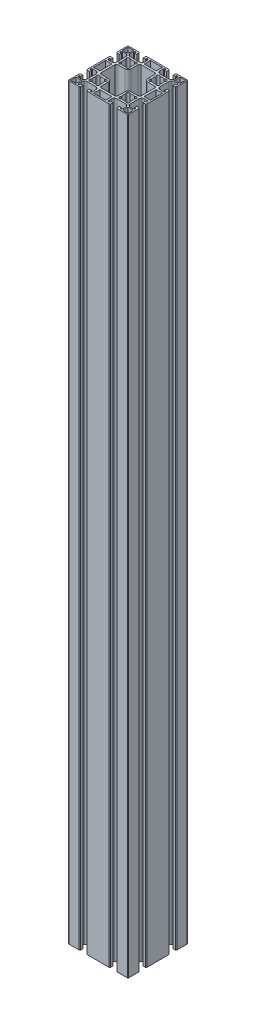
from build123d import *

# Parameters (mm, degrees)
SKETCH1_W           = 8.4
SKETCH1_H           = 16.2
SKETCH1_W_2         = 7.2
SKETCH1_H_2         = 7.2
SKETCH1_W_3         = 16.2
SKETCH1_H_3         = 8.4
BOSS_EXTRUDE1_DEPTH = 1000


with BuildPart() as part:
    # Sketch1 → Boss-Extrude1 (new body)
    with BuildSketch(Plane(origin=(0, 0, 0), x_dir=(1, 0, 0), z_dir=(0, 1, 0))):
        with BuildLine():
            Line((39.881157874, -42.704615906), (39.881157874, -28.954615906))
            Line((39.881157874, -28.954615906), (38.881157874, -27.954615906))
            Line((38.881157874, -27.954615906), (35.881157874, -27.954615906))
            Line((35.881157874, -27.954615906), (35.881157874, -30.954615906))
            Line((35.881157874, -30.954615906), (37.485281077, -30.954615906))
            ThreePointArc((37.485281077, -30.954615906), (37.868303299, -31.133222101), (37.977684954, -31.541439995))
            Line((37.977684954, -31.541439995), (37.797926779, -32.560899266))
            ThreePointArc((37.797926779, -32.560899266), (37.49010865, -33.094055905), (36.911599801, -33.304615906))
            Line((36.911599801, -33.304615906), (32.215023493, -33.304615906))
            ThreePointArc((32.215023493, -33.304615906), (31.066973196, -33.076254504), (30.09370315, -32.42593625))
            Line((30.09370315, -32.42593625), (29.55983753, -31.89207063))
            ThreePointArc((29.55983753, -31.89207063), (28.909519276, -30.918800583), (28.681157874, -29.770750286))
            Line((28.681157874, -29.770750286), (28.681157874, -17.638481526))
            ThreePointArc((28.681157874, -17.638481526), (28.909519276, -16.490431229), (29.55983753, -15.517161182))
            Line((29.55983753, -15.517161182), (30.09370315, -14.983295562))
            ThreePointArc((30.09370315, -14.983295562), (31.066973196, -14.332977309), (32.215023493, -14.104615906))
            Line((32.215023493, -14.104615906), (36.911599801, -14.104615906))
            ThreePointArc((36.911599801, -14.104615906), (37.49010865, -14.315175907), (37.797926779, -14.848332546))
            Line((37.797926779, -14.848332546), (37.977684954, -15.867791817))
            ThreePointArc((37.977684954, -15.867791817), (37.868303299, -16.276009711), (37.485281077, -16.454615906))
            Line((37.485281077, -16.454615906), (35.881157874, -16.454615906))
            Line((35.881157874, -16.454615906), (35.881157874, -19.454615906))
            Line((35.881157874, -19.454615906), (38.881157874, -19.454615906))
            Line((38.881157874, -19.454615906), (39.881157874, -18.454615906))
            Line((39.881157874, -18.454615906), (39.881157874, 11.045384094))
            Line((39.881157874, 11.045384094), (38.881157874, 12.045384094))
            Line((38.881157874, 12.045384094), (35.881157874, 12.045384094))
            Line((35.881157874, 12.045384094), (35.881157874, 9.045384094))
            Line((35.881157874, 9.045384094), (37.485281077, 9.045384094))
            ThreePointArc((37.485281077, 9.045384094), (37.868303299, 8.866777899), (37.977684954, 8.458560005))
            Line((37.977684954, 8.458560005), (37.797926779, 7.439100734))
            ThreePointArc((37.797926779, 7.439100734), (37.49010865, 6.905944095), (36.911599801, 6.695384094))
            Line((36.911599801, 6.695384094), (32.215023493, 6.695384094))
            ThreePointArc((32.215023493, 6.695384094), (31.066973196, 6.923745496), (30.09370315, 7.57406375))
            Line((30.09370315, 7.57406375), (29.55983753, 8.10792937))
            ThreePointArc((29.55983753, 8.10792937), (28.909519276, 9.081199417), (28.681157874, 10.229249714))
            Line((28.681157874, 10.229249714), (28.681157874, 22.361518474))
            ThreePointArc((28.681157874, 22.361518474), (28.909519276, 23.509568771), (29.55983753, 24.482838818))
            Line((29.55983753, 24.482838818), (30.09370315, 25.016704438))
            ThreePointArc((30.09370315, 25.016704438), (31.066973196, 25.667022691), (32.215023493, 25.895384094))
            Line((32.215023493, 25.895384094), (36.911599801, 25.895384094))
            ThreePointArc((36.911599801, 25.895384094), (37.49010865, 25.684824093), (37.797926779, 25.151667454))
            Line((37.797926779, 25.151667454), (37.977684954, 24.132208183))
            ThreePointArc((37.977684954, 24.132208183), (37.868303299, 23.723990289), (37.485281077, 23.545384094))
            Line((37.485281077, 23.545384094), (35.881157874, 23.545384094))
            Line((35.881157874, 23.545384094), (35.881157874, 20.545384094))
            Line((35.881157874, 20.545384094), (38.881157874, 20.545384094))
            Line((38.881157874, 20.545384094), (39.881157874, 21.545384094))
            Line((39.881157874, 21.545384094), (39.881157874, 35.295384094))
            ThreePointArc((39.881157874, 35.295384094), (39.588264655, 36.002490875), (38.881157874, 36.295384094))
            Line((38.881157874, 36.295384094), (25.131157874, 36.295384094))
            Line((25.131157874, 36.295384094), (24.131157874, 35.295384094))
            Line((24.131157874, 35.295384094), (24.131157874, 32.295384094))
            Line((24.131157874, 32.295384094), (27.131157874, 32.295384094))
            Line((27.131157874, 32.295384094), (27.131157874, 33.899507298))
            ThreePointArc((27.131157874, 33.899507298), (27.309764069, 34.282529519), (27.717981962, 34.391911174))
            Line((27.717981962, 34.391911174), (28.737441233, 34.212152999))
            ThreePointArc((28.737441233, 34.212152999), (29.270597872, 33.90433487), (29.481157874, 33.325826021))
            Line((29.481157874, 33.325826021), (29.481157874, 28.629249714))
            ThreePointArc((29.481157874, 28.629249714), (29.252796471, 27.481199417), (28.602478217, 26.50792937))
            Line((28.602478217, 26.50792937), (28.068612597, 25.97406375))
            ThreePointArc((28.068612597, 25.97406375), (27.095342551, 25.323745496), (25.947292254, 25.095384094))
            Line((25.947292254, 25.095384094), (13.815023493, 25.095384094))
            ThreePointArc((13.815023493, 25.095384094), (12.666973196, 25.323745496), (11.69370315, 25.97406375))
            Line((11.69370315, 25.97406375), (11.15983753, 26.50792937))
            ThreePointArc((11.15983753, 26.50792937), (10.509519276, 27.481199417), (10.281157874, 28.629249714))
            Line((10.281157874, 28.629249714), (10.281157874, 33.325826021))
            ThreePointArc((10.281157874, 33.325826021), (10.491717875, 33.90433487), (11.024874514, 34.212152999))
            Line((11.024874514, 34.212152999), (12.044333785, 34.391911174))
            ThreePointArc((12.044333785, 34.391911174), (12.452551678, 34.282529519), (12.631157874, 33.899507298))
            Line((12.631157874, 33.899507298), (12.631157874, 32.295384094))
            Line((12.631157874, 32.295384094), (15.631157874, 32.295384094))
            Line((15.631157874, 32.295384094), (15.631157874, 35.295384094))
            Line((15.631157874, 35.295384094), (14.631157874, 36.295384094))
            Line((14.631157874, 36.295384094), (-14.868842126, 36.295384094))
            Line((-14.868842126, 36.295384094), (-15.868842126, 35.295384094))
            Line((-15.868842126, 35.295384094), (-15.868842126, 32.295384094))
            Line((-15.868842126, 32.295384094), (-12.868842126, 32.295384094))
            Line((-12.868842126, 32.295384094), (-12.868842126, 33.899507298))
            ThreePointArc((-12.868842126, 33.899507298), (-12.690235931, 34.282529519), (-12.282018038, 34.391911174))
            Line((-12.282018038, 34.391911174), (-11.262558767, 34.212152999))
            ThreePointArc((-11.262558767, 34.212152999), (-10.729402128, 33.90433487), (-10.518842126, 33.325826021))
            Line((-10.518842126, 33.325826021), (-10.518842126, 28.629249714))
            ThreePointArc((-10.518842126, 28.629249714), (-10.747203529, 27.481199417), (-11.397521783, 26.50792937))
            Line((-11.397521783, 26.50792937), (-11.931387403, 25.97406375))
            ThreePointArc((-11.931387403, 25.97406375), (-12.904657449, 25.323745496), (-14.052707746, 25.095384094))
            Line((-14.052707746, 25.095384094), (-26.184976507, 25.095384094))
            ThreePointArc((-26.184976507, 25.095384094), (-27.333026804, 25.323745496), (-28.30629685, 25.97406375))
            Line((-28.30629685, 25.97406375), (-28.84016247, 26.50792937))
            ThreePointArc((-28.84016247, 26.50792937), (-29.490480724, 27.481199417), (-29.718842126, 28.629249714))
            Line((-29.718842126, 28.629249714), (-29.718842126, 33.325826021))
            ThreePointArc((-29.718842126, 33.325826021), (-29.508282125, 33.90433487), (-28.975125486, 34.212152999))
            Line((-28.975125486, 34.212152999), (-27.955666215, 34.391911174))
            ThreePointArc((-27.955666215, 34.391911174), (-27.547448322, 34.282529519), (-27.368842126, 33.899507298))
            Line((-27.368842126, 33.899507298), (-27.368842126, 32.295384094))
            Line((-27.368842126, 32.295384094), (-24.368842126, 32.295384094))
            Line((-24.368842126, 32.295384094), (-24.368842126, 35.295384094))
            Line((-24.368842126, 35.295384094), (-25.368842126, 36.295384094))
            Line((-25.368842126, 36.295384094), (-39.118842126, 36.295384094))
            ThreePointArc((-39.118842126, 36.295384094), (-39.825948908, 36.002490875), (-40.118842126, 35.295384094))
            Line((-40.118842126, 35.295384094), (-40.118842126, 21.545384094))
            Line((-40.118842126, 21.545384094), (-39.118842126, 20.545384094))
            Line((-39.118842126, 20.545384094), (-36.118842126, 20.545384094))
            Line((-36.118842126, 20.545384094), (-36.118842126, 23.545384094))
            Line((-36.118842126, 23.545384094), (-37.72296533, 23.545384094))
            ThreePointArc((-37.72296533, 23.545384094), (-38.105987552, 23.723990289), (-38.215369207, 24.132208183))
            Line((-38.215369207, 24.132208183), (-38.035611031, 25.151667454))
            ThreePointArc((-38.035611031, 25.151667454), (-37.727792902, 25.684824093), (-37.149284054, 25.895384094))
            Line((-37.149284054, 25.895384094), (-32.452707746, 25.895384094))
            ThreePointArc((-32.452707746, 25.895384094), (-31.304657449, 25.667022691), (-30.331387403, 25.016704438))
            Line((-30.331387403, 25.016704438), (-29.797521783, 24.482838818))
            ThreePointArc((-29.797521783, 24.482838818), (-29.147203529, 23.509568771), (-28.918842126, 22.361518474))
            Line((-28.918842126, 22.361518474), (-28.918842126, 10.229249714))
            ThreePointArc((-28.918842126, 10.229249714), (-29.147203529, 9.081199417), (-29.797521783, 8.10792937))
            Line((-29.797521783, 8.10792937), (-30.331387403, 7.57406375))
            ThreePointArc((-30.331387403, 7.57406375), (-31.304657449, 6.923745496), (-32.452707746, 6.695384094))
            Line((-32.452707746, 6.695384094), (-37.149284054, 6.695384094))
            ThreePointArc((-37.149284054, 6.695384094), (-37.727792902, 6.905944095), (-38.035611031, 7.439100734))
            Line((-38.035611031, 7.439100734), (-38.215369207, 8.458560005))
            ThreePointArc((-38.215369207, 8.458560005), (-38.105987552, 8.866777899), (-37.72296533, 9.045384094))
            Line((-37.72296533, 9.045384094), (-36.118842126, 9.045384094))
            Line((-36.118842126, 9.045384094), (-36.118842126, 12.045384094))
            Line((-36.118842126, 12.045384094), (-39.118842126, 12.045384094))
            Line((-39.118842126, 12.045384094), (-40.118842126, 11.045384094))
            Line((-40.118842126, 11.045384094), (-40.118842126, -18.454615906))
            Line((-40.118842126, -18.454615906), (-39.118842126, -19.454615906))
            Line((-39.118842126, -19.454615906), (-36.118842126, -19.454615906))
            Line((-36.118842126, -19.454615906), (-36.118842126, -16.454615906))
            Line((-36.118842126, -16.454615906), (-37.72296533, -16.454615906))
            ThreePointArc((-37.72296533, -16.454615906), (-38.105987552, -16.276009711), (-38.215369207, -15.867791817))
            Line((-38.215369207, -15.867791817), (-38.035611031, -14.848332546))
            ThreePointArc((-38.035611031, -14.848332546), (-37.727792902, -14.315175907), (-37.149284054, -14.104615906))
            Line((-37.149284054, -14.104615906), (-32.452707746, -14.104615906))
            ThreePointArc((-32.452707746, -14.104615906), (-31.304657449, -14.332977309), (-30.331387403, -14.983295562))
            Line((-30.331387403, -14.983295562), (-29.797521783, -15.517161182))
            ThreePointArc((-29.797521783, -15.517161182), (-29.147203529, -16.490431229), (-28.918842126, -17.638481526))
            Line((-28.918842126, -17.638481526), (-28.918842126, -29.770750286))
            ThreePointArc((-28.918842126, -29.770750286), (-29.147203529, -30.918800583), (-29.797521783, -31.89207063))
            Line((-29.797521783, -31.89207063), (-30.331387403, -32.42593625))
            ThreePointArc((-30.331387403, -32.42593625), (-31.304657449, -33.076254504), (-32.452707746, -33.304615906))
            Line((-32.452707746, -33.304615906), (-37.149284054, -33.304615906))
            ThreePointArc((-37.149284054, -33.304615906), (-37.727792902, -33.094055905), (-38.035611031, -32.560899266))
            Line((-38.035611031, -32.560899266), (-38.215369207, -31.541439995))
            ThreePointArc((-38.215369207, -31.541439995), (-38.105987552, -31.133222101), (-37.72296533, -30.954615906))
            Line((-37.72296533, -30.954615906), (-36.118842126, -30.954615906))
            Line((-36.118842126, -30.954615906), (-36.118842126, -27.954615906))
            Line((-36.118842126, -27.954615906), (-39.118842126, -27.954615906))
            Line((-39.118842126, -27.954615906), (-40.118842126, -28.954615906))
            Line((-40.118842126, -28.954615906), (-40.118842126, -42.704615906))
            ThreePointArc((-40.118842126, -42.704615906), (-39.825948908, -43.411722687), (-39.118842126, -43.704615906))
            Line((-39.118842126, -43.704615906), (-25.368842126, -43.704615906))
            Line((-25.368842126, -43.704615906), (-24.368842126, -42.704615906))
            Line((-24.368842126, -42.704615906), (-24.368842126, -39.704615906))
            Line((-24.368842126, -39.704615906), (-27.368842126, -39.704615906))
            Line((-27.368842126, -39.704615906), (-27.368842126, -41.30873911))
            ThreePointArc((-27.368842126, -41.30873911), (-27.547448322, -41.691761331), (-27.955666215, -41.801142986))
            Line((-27.955666215, -41.801142986), (-28.975125486, -41.621384811))
            ThreePointArc((-28.975125486, -41.621384811), (-29.508282125, -41.313566682), (-29.718842126, -40.735057833))
            Line((-29.718842126, -40.735057833), (-29.718842126, -36.038481526))
            ThreePointArc((-29.718842126, -36.038481526), (-29.490480724, -34.890431229), (-28.84016247, -33.917161182))
            Line((-28.84016247, -33.917161182), (-28.30629685, -33.383295562))
            ThreePointArc((-28.30629685, -33.383295562), (-27.333026804, -32.732977309), (-26.184976507, -32.504615906))
            Line((-26.184976507, -32.504615906), (-14.052707746, -32.504615906))
            ThreePointArc((-14.052707746, -32.504615906), (-12.904657449, -32.732977309), (-11.931387403, -33.383295562))
            Line((-11.931387403, -33.383295562), (-11.397521783, -33.917161182))
            ThreePointArc((-11.397521783, -33.917161182), (-10.747203529, -34.890431229), (-10.518842126, -36.038481526))
            Line((-10.518842126, -36.038481526), (-10.518842126, -40.735057833))
            ThreePointArc((-10.518842126, -40.735057833), (-10.729402128, -41.313566682), (-11.262558767, -41.621384811))
            Line((-11.262558767, -41.621384811), (-12.282018038, -41.801142986))
            ThreePointArc((-12.282018038, -41.801142986), (-12.690235931, -41.691761331), (-12.868842126, -41.30873911))
            Line((-12.868842126, -41.30873911), (-12.868842126, -39.704615906))
            Line((-12.868842126, -39.704615906), (-15.868842126, -39.704615906))
            Line((-15.868842126, -39.704615906), (-15.868842126, -42.704615906))
            Line((-15.868842126, -42.704615906), (-14.868842126, -43.704615906))
            Line((-14.868842126, -43.704615906), (14.631157874, -43.704615906))
            Line((14.631157874, -43.704615906), (15.631157874, -42.704615906))
            Line((15.631157874, -42.704615906), (15.631157874, -39.704615906))
            Line((15.631157874, -39.704615906), (12.631157874, -39.704615906))
            Line((12.631157874, -39.704615906), (12.631157874, -41.30873911))
            ThreePointArc((12.631157874, -41.30873911), (12.452551678, -41.691761331), (12.044333785, -41.801142986))
            Line((12.044333785, -41.801142986), (11.024874514, -41.621384811))
            ThreePointArc((11.024874514, -41.621384811), (10.491717875, -41.313566682), (10.281157874, -40.735057833))
            Line((10.281157874, -40.735057833), (10.281157874, -36.038481526))
            ThreePointArc((10.281157874, -36.038481526), (10.509519276, -34.890431229), (11.15983753, -33.917161182))
            Line((11.15983753, -33.917161182), (11.69370315, -33.383295562))
            ThreePointArc((11.69370315, -33.383295562), (12.666973196, -32.732977309), (13.815023493, -32.504615906))
            Line((13.815023493, -32.504615906), (25.947292254, -32.504615906))
            ThreePointArc((25.947292254, -32.504615906), (27.095342551, -32.732977309), (28.068612597, -33.383295562))
            Line((28.068612597, -33.383295562), (28.602478217, -33.917161182))
            ThreePointArc((28.602478217, -33.917161182), (29.252796471, -34.890431229), (29.481157874, -36.038481526))
            Line((29.481157874, -36.038481526), (29.481157874, -40.735057833))
            ThreePointArc((29.481157874, -40.735057833), (29.270597872, -41.313566682), (28.737441233, -41.621384811))
            Line((28.737441233, -41.621384811), (27.717981962, -41.801142986))
            ThreePointArc((27.717981962, -41.801142986), (27.309764069, -41.691761331), (27.131157874, -41.30873911))
            Line((27.131157874, -41.30873911), (27.131157874, -39.704615906))
            Line((27.131157874, -39.704615906), (24.131157874, -39.704615906))
            Line((24.131157874, -39.704615906), (24.131157874, -42.704615906))
            Line((24.131157874, -42.704615906), (25.131157874, -43.704615906))
            Line((25.131157874, -43.704615906), (38.881157874, -43.704615906))
            ThreePointArc((38.881157874, -43.704615906), (39.588264655, -43.411722687), (39.881157874, -42.704615906))
        make_face()
        with BuildLine():
            Line((16.522400663, 10.108199759), (17.10833788, 10.694136975))
            ThreePointArc((17.10833788, 10.694136975), (19.881157874, 10.045384094), (22.653977867, 10.694136975))
            Line((22.653977867, 10.694136975), (23.239915084, 10.108199759))
            ThreePointArc((23.239915084, 10.108199759), (26.068342209, 10.108199759), (26.068342209, 12.936626883))
            Line((26.068342209, 12.936626883), (25.482404992, 13.5225641))
            ThreePointArc((25.482404992, 13.5225641), (26.131157874, 16.295384094), (25.482404992, 19.068204088))
            Line((25.482404992, 19.068204088), (26.068342209, 19.654141305))
            ThreePointArc((26.068342209, 19.654141305), (26.068342209, 22.482568429), (23.239915084, 22.482568429))
            Line((23.239915084, 22.482568429), (22.653977867, 21.896631212))
            ThreePointArc((22.653977867, 21.896631212), (19.881157874, 22.545384094), (17.10833788, 21.896631212))
            Line((17.10833788, 21.896631212), (16.522400663, 22.482568429))
            ThreePointArc((16.522400663, 22.482568429), (13.693973538, 22.482568429), (13.693973538, 19.654141305))
            Line((13.693973538, 19.654141305), (14.279910755, 19.068204088))
            ThreePointArc((14.279910755, 19.068204088), (13.631157874, 16.295384094), (14.279910755, 13.5225641))
            Line((14.279910755, 13.5225641), (13.693973538, 12.936626883))
            ThreePointArc((13.693973538, 12.936626883), (13.693973538, 10.108199759), (16.522400663, 10.108199759))
        make_face(mode=Mode.SUBTRACT)
        with Locations((-33.918842126, -3.704615906)):
            Rectangle(SKETCH1_W, SKETCH1_H, mode=Mode.SUBTRACT)
        with BuildLine():
            Line((-23.477599337, 10.108199759), (-22.89166212, 10.694136975))
            ThreePointArc((-22.89166212, 10.694136975), (-20.118842126, 10.045384094), (-17.346022133, 10.694136975))
            Line((-17.346022133, 10.694136975), (-16.760084916, 10.108199759))
            ThreePointArc((-16.760084916, 10.108199759), (-13.931657791, 10.108199759), (-13.931657791, 12.936626883))
            Line((-13.931657791, 12.936626883), (-14.517595008, 13.5225641))
            ThreePointArc((-14.517595008, 13.5225641), (-13.868842126, 16.295384094), (-14.517595008, 19.068204088))
            Line((-14.517595008, 19.068204088), (-13.931657791, 19.654141305))
            ThreePointArc((-13.931657791, 19.654141305), (-13.931657791, 22.482568429), (-16.760084916, 22.482568429))
            Line((-16.760084916, 22.482568429), (-17.346022133, 21.896631212))
            ThreePointArc((-17.346022133, 21.896631212), (-20.118842126, 22.545384094), (-22.89166212, 21.896631212))
            Line((-22.89166212, 21.896631212), (-23.477599337, 22.482568429))
            ThreePointArc((-23.477599337, 22.482568429), (-26.306026462, 22.482568429), (-26.306026462, 19.654141305))
            Line((-26.306026462, 19.654141305), (-25.720089245, 19.068204088))
            ThreePointArc((-25.720089245, 19.068204088), (-26.368842126, 16.295384094), (-25.720089245, 13.5225641))
            Line((-25.720089245, 13.5225641), (-26.306026462, 12.936626883))
            ThreePointArc((-26.306026462, 12.936626883), (-26.306026462, 10.108199759), (-23.477599337, 10.108199759))
        make_face(mode=Mode.SUBTRACT)
        with BuildLine():
            Line((23.239915084, -17.517431571), (22.653977867, -18.103368788))
            ThreePointArc((22.653977867, -18.103368788), (19.881157874, -17.454615906), (17.10833788, -18.103368788))
            Line((17.10833788, -18.103368788), (16.522400663, -17.517431571))
            ThreePointArc((16.522400663, -17.517431571), (13.693973538, -17.517431571), (13.693973538, -20.345858695))
            Line((13.693973538, -20.345858695), (14.279910755, -20.931795912))
            ThreePointArc((14.279910755, -20.931795912), (13.631157874, -23.704615906), (14.279910755, -26.4774359))
            Line((14.279910755, -26.4774359), (13.693973538, -27.063373117))
            ThreePointArc((13.693973538, -27.063373117), (13.693973538, -29.891800241), (16.522400663, -29.891800241))
            Line((16.522400663, -29.891800241), (17.10833788, -29.305863025))
            ThreePointArc((17.10833788, -29.305863025), (19.881157874, -29.954615906), (22.653977867, -29.305863025))
            Line((22.653977867, -29.305863025), (23.239915084, -29.891800241))
            ThreePointArc((23.239915084, -29.891800241), (26.068342209, -29.891800241), (26.068342209, -27.063373117))
            Line((26.068342209, -27.063373117), (25.482404992, -26.4774359))
            ThreePointArc((25.482404992, -26.4774359), (26.131157874, -23.704615906), (25.482404992, -20.931795912))
            Line((25.482404992, -20.931795912), (26.068342209, -20.345858695))
            ThreePointArc((26.068342209, -20.345858695), (26.068342209, -17.517431571), (23.239915084, -17.517431571))
        make_face(mode=Mode.SUBTRACT)
        with Locations((-34.918842126, -38.504615906)):
            Rectangle(SKETCH1_W_2, SKETCH1_H_2, mode=Mode.SUBTRACT)
        with BuildLine():
            Line((-16.760084916, -17.517431571), (-17.346022133, -18.103368788))
            ThreePointArc((-17.346022133, -18.103368788), (-20.118842126, -17.454615906), (-22.89166212, -18.103368788))
            Line((-22.89166212, -18.103368788), (-23.477599337, -17.517431571))
            ThreePointArc((-23.477599337, -17.517431571), (-26.306026462, -17.517431571), (-26.306026462, -20.345858695))
            Line((-26.306026462, -20.345858695), (-25.720089245, -20.931795912))
            ThreePointArc((-25.720089245, -20.931795912), (-26.368842126, -23.704615906), (-25.720089245, -26.4774359))
            Line((-25.720089245, -26.4774359), (-26.306026462, -27.063373117))
            ThreePointArc((-26.306026462, -27.063373117), (-26.306026462, -29.891800241), (-23.477599337, -29.891800241))
            Line((-23.477599337, -29.891800241), (-22.89166212, -29.305863025))
            ThreePointArc((-22.89166212, -29.305863025), (-20.118842126, -29.954615906), (-17.346022133, -29.305863025))
            Line((-17.346022133, -29.305863025), (-16.760084916, -29.891800241))
            ThreePointArc((-16.760084916, -29.891800241), (-13.931657791, -29.891800241), (-13.931657791, -27.063373117))
            Line((-13.931657791, -27.063373117), (-14.517595008, -26.4774359))
            ThreePointArc((-14.517595008, -26.4774359), (-13.868842126, -23.704615906), (-14.517595008, -20.931795912))
            Line((-14.517595008, -20.931795912), (-13.931657791, -20.345858695))
            ThreePointArc((-13.931657791, -20.345858695), (-13.931657791, -17.517431571), (-16.760084916, -17.517431571))
        make_face(mode=Mode.SUBTRACT)
        with Locations((-34.918842126, 31.095384094)):
            Rectangle(SKETCH1_W_2, SKETCH1_H_2, mode=Mode.SUBTRACT)
        with Locations((34.681157874, -38.504615906)):
            Rectangle(SKETCH1_W_2, SKETCH1_H_2, mode=Mode.SUBTRACT)
        with Locations((34.681157874, 31.095384094)):
            Rectangle(SKETCH1_W_2, SKETCH1_H_2, mode=Mode.SUBTRACT)
        with Locations((-0.118842126, 30.095384094)):
            Rectangle(SKETCH1_W_3, SKETCH1_H_3, mode=Mode.SUBTRACT)
        with BuildLine():
            Line((11.081157874, -28.504615906), (11.081157874, -18.904615906))
            ThreePointArc((11.081157874, -18.904615906), (12.252730749, -16.076188781), (15.081157874, -14.904615906))
            Line((15.081157874, -14.904615906), (24.681157874, -14.904615906))
            ThreePointArc((24.681157874, -14.904615906), (26.095371436, -14.318829468), (26.681157874, -12.904615906))
            Line((26.681157874, -12.904615906), (26.681157874, 5.495384094))
            ThreePointArc((26.681157874, 5.495384094), (26.095371436, 6.909597656), (24.681157874, 7.495384094))
            Line((24.681157874, 7.495384094), (15.081157874, 7.495384094))
            ThreePointArc((15.081157874, 7.495384094), (12.252730749, 8.666956969), (11.081157874, 11.495384094))
            Line((11.081157874, 11.495384094), (11.081157874, 21.095384094))
            ThreePointArc((11.081157874, 21.095384094), (10.495371436, 22.509597656), (9.081157874, 23.095384094))
            Line((9.081157874, 23.095384094), (-9.318842126, 23.095384094))
            ThreePointArc((-9.318842126, 23.095384094), (-10.733055689, 22.509597656), (-11.318842126, 21.095384094))
            Line((-11.318842126, 21.095384094), (-11.318842126, 11.495384094))
            ThreePointArc((-11.318842126, 11.495384094), (-12.490415002, 8.666956969), (-15.318842126, 7.495384094))
            Line((-15.318842126, 7.495384094), (-24.918842126, 7.495384094))
            ThreePointArc((-24.918842126, 7.495384094), (-26.333055689, 6.909597656), (-26.918842126, 5.495384094))
            Line((-26.918842126, 5.495384094), (-26.918842126, -12.904615906))
            ThreePointArc((-26.918842126, -12.904615906), (-26.333055689, -14.318829468), (-24.918842126, -14.904615906))
            Line((-24.918842126, -14.904615906), (-15.318842126, -14.904615906))
            ThreePointArc((-15.318842126, -14.904615906), (-12.490415002, -16.076188781), (-11.318842126, -18.904615906))
            Line((-11.318842126, -18.904615906), (-11.318842126, -28.504615906))
            ThreePointArc((-11.318842126, -28.504615906), (-10.733055689, -29.918829468), (-9.318842126, -30.504615906))
            Line((-9.318842126, -30.504615906), (9.081157874, -30.504615906))
            ThreePointArc((9.081157874, -30.504615906), (10.495371436, -29.918829468), (11.081157874, -28.504615906))
        make_face(mode=Mode.SUBTRACT)
        with Locations((-0.118842126, -37.504615906)):
            Rectangle(SKETCH1_W_3, SKETCH1_H_3, mode=Mode.SUBTRACT)
        with Locations((33.681157874, -3.704615906)):
            Rectangle(SKETCH1_W, SKETCH1_H, mode=Mode.SUBTRACT)
    extrude(amount=BOSS_EXTRUDE1_DEPTH)


solid = part.part
